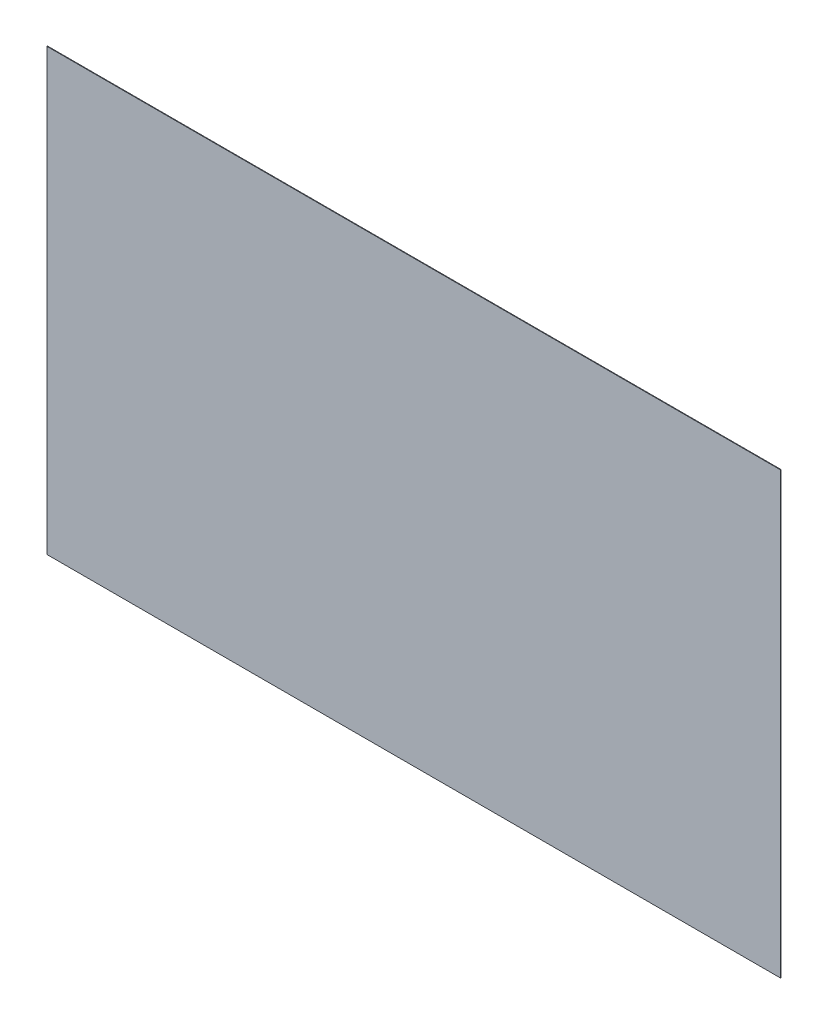
from build123d import *

# Parameters (mm, degrees)
SKETCH1_W           = 1000
SKETCH1_H           = 600
BOSS_EXTRUDE1_DEPTH = 0.8


with BuildPart() as part:
    # Sketch1 → Boss-Extrude1 (new body)
    with BuildSketch(Plane.XY):
        with Locations((500, 300)):
            Rectangle(SKETCH1_W, SKETCH1_H)
    extrude(amount=BOSS_EXTRUDE1_DEPTH)


solid = part.part
